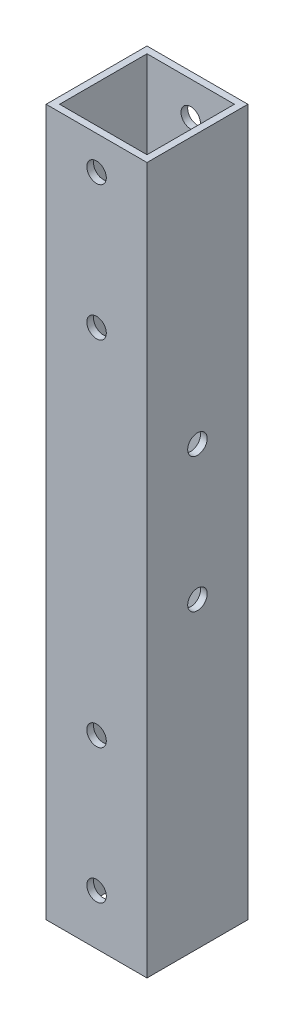
from build123d import *

# Parameters (mm, degrees)
SKETCH_1_W          = 15
SKETCH_1_H          = 15
SKETCH_1_W_2        = 13
SKETCH_1_H_2        = 13
EXTRUDE_1_DEPTH     = 105
SKETCH_2_R          = 1.45
CUT_EXTRUDE_1_DEPTH = 107.330851591
SKETCH_3_R          = 1.45
CUT_EXTRUDE_2_DEPTH = 107.330851591


with BuildPart() as part:
    # 草图1 → 拉伸-薄壁1 (new body)
    with BuildSketch(Plane(origin=(0, 0, 0), x_dir=(1, 0, 0), z_dir=(0, 1, 0))):
        Rectangle(SKETCH_1_W, SKETCH_1_H)
        Rectangle(SKETCH_1_W_2, SKETCH_1_H_2, mode=Mode.SUBTRACT)
    extrude(amount=EXTRUDE_1_DEPTH)

    # 草图2 → 切除-拉伸1 (cut, through all)
    with BuildSketch(Plane.XY.offset(7.5)):
        with Locations((0, 7.5)):
            Circle(SKETCH_2_R)
        with Locations((0, 27.5)):
            Circle(SKETCH_2_R)
        with Locations((0, 100)):
            Circle(SKETCH_2_R)
        with Locations((0, 80)):
            Circle(SKETCH_2_R)
    extrude(amount=-CUT_EXTRUDE_1_DEPTH, mode=Mode.SUBTRACT)

    # 草图3 → 切除-拉伸2 (cut, through all)
    with BuildSketch(Plane(origin=(7.5, 0, 0), x_dir=(0, 0, -1), z_dir=(1, 0, 0))):
        with Locations((0, 65)):
            Circle(SKETCH_3_R)
        with Locations((0, 45)):
            Circle(SKETCH_3_R)
    extrude(amount=-CUT_EXTRUDE_2_DEPTH, mode=Mode.SUBTRACT)


solid = part.part
